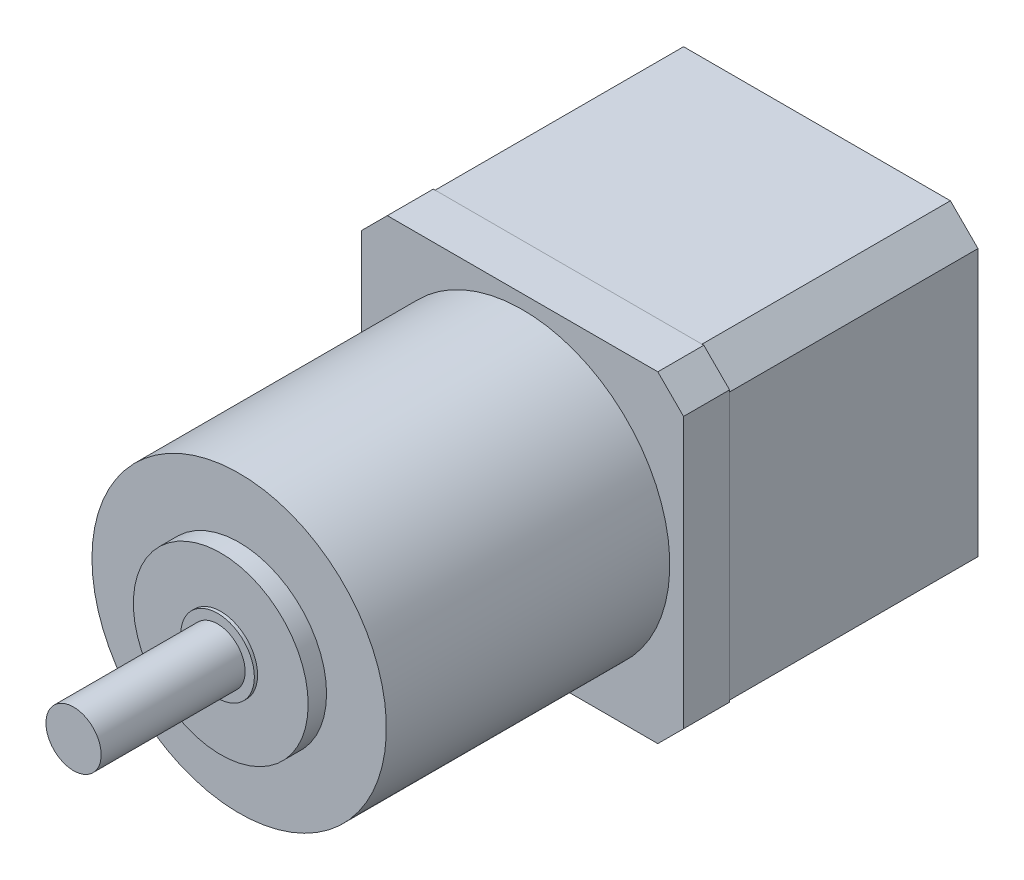
from build123d import *

# Parameters (mm, degrees)
SKETCH1_W           = 35
SKETCH1_H           = 35
BOSS_EXTRUDE1_DEPTH = 27
CHAMFER1_SIZE       = 3
SKETCH2_W           = 35
SKETCH2_H           = 35
BOSS_EXTRUDE2_DEPTH = 5
CHAMFER2_SIZE       = 2.8
SKETCH3_R           = 16
BOSS_EXTRUDE3_DEPTH = 30.8
SKETCH4_R           = 9.5
BOSS_EXTRUDE4_DEPTH = 2
SKETCH6_R           = 3
BOSS_EXTRUDE5_DEPTH = 18
SKETCH7_R           = 4
BOSS_EXTRUDE6_DEPTH = 0.35


with BuildPart() as part:
    # Sketch1 → Boss-Extrude1 (new body)
    with BuildSketch(Plane.XY):
        Rectangle(SKETCH1_W, SKETCH1_H)
    extrude(amount=BOSS_EXTRUDE1_DEPTH)

    # Chamfer1
    chamfer1_edges = [part.edges().sort_by_distance(p)[0] for p in [
        (17.5, -17.5, 13.5),
        (-17.5, -17.5, 13.5),
        (-17.5, 17.5, 13.5),
        (17.5, 17.5, 13.5),
    ]]
    chamfer(chamfer1_edges, length=CHAMFER1_SIZE)


with BuildPart() as body_2:
    # Sketch2 → Boss-Extrude2 (new body)
    with BuildSketch(Plane.XY.offset(27)):
        Rectangle(SKETCH2_W, SKETCH2_H)
    extrude(amount=BOSS_EXTRUDE2_DEPTH)

    # Chamfer2
    chamfer2_edges = [body_2.edges().sort_by_distance(p)[0] for p in [
        (17.5, -17.5, 29.5),
        (-17.5, -17.5, 29.5),
        (-17.5, 17.5, 29.5),
        (17.5, 17.5, 29.5),
    ]]
    chamfer(chamfer2_edges, length=CHAMFER2_SIZE)

    # Sketch3 → Boss-Extrude3 (add)
    with BuildSketch(Plane.XY.offset(32)):
        with Locations(Location((0, 0, 0), (0, 0, 180))):
            Circle(SKETCH3_R)
    extrude(amount=BOSS_EXTRUDE3_DEPTH)

    # Sketch4 → Boss-Extrude4 (add)
    with BuildSketch(Plane.XY.offset(62.8)):
        Circle(SKETCH4_R)
    extrude(amount=BOSS_EXTRUDE4_DEPTH)

    # Sketch6 → Boss-Extrude5 (add)
    with BuildSketch(Plane.XY.offset(62.8)):
        Circle(SKETCH6_R)
    extrude(amount=BOSS_EXTRUDE5_DEPTH)

    # Sketch7 → Boss-Extrude6 (add)
    with BuildSketch(Plane.XY.offset(64.8)):
        Circle(SKETCH7_R)
    extrude(amount=BOSS_EXTRUDE6_DEPTH)


solid = Compound([part.part, body_2.part])
